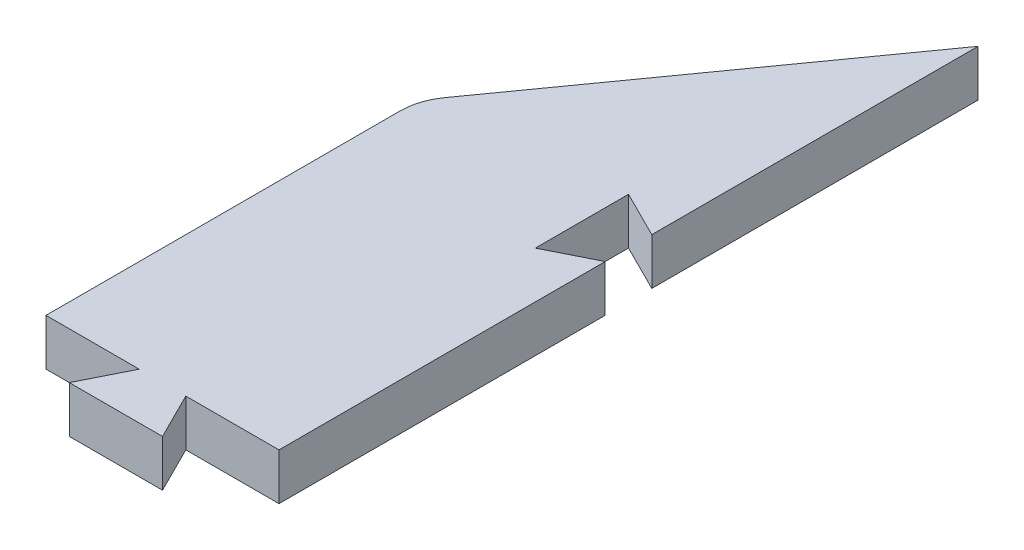
from build123d import *

# Parameters (mm, degrees)
EXTRUDE_1_DEPTH = 4


with BuildPart() as part:
    # Эскиз1 → Бобышка-Вытянуть1 (new body)
    with BuildSketch(Plane(origin=(0, 0, 0), x_dir=(1, 0, 0), z_dir=(0, 1, 0))):
        with BuildLine():
            Line((10, -17.5), (2, -17.5))
            Line((2, -17.5), (4, -21.5))
            Line((4, -21.5), (-4, -21.5))
            Line((-4, -21.5), (-2, -17.5))
            Line((-2, -17.5), (-10, -17.5))
            Line((-10, -17.5), (-10, 12.897674733))
            ThreePointArc((-10, 12.897674733), (-9.761477543, 14.423561888), (-9.068667356, 15.803865702))
            Line((-9.068667356, 15.803865702), (10, 42.5))
            Line((10, 42.5), (10, 14.5))
            Line((10, 14.5), (6, 16.5))
            Line((6, 16.5), (6, 8.5))
            Line((6, 8.5), (10, 10.5))
            Line((10, 10.5), (10, -17.5))
        make_face()
    extrude(amount=EXTRUDE_1_DEPTH)


solid = part.part
